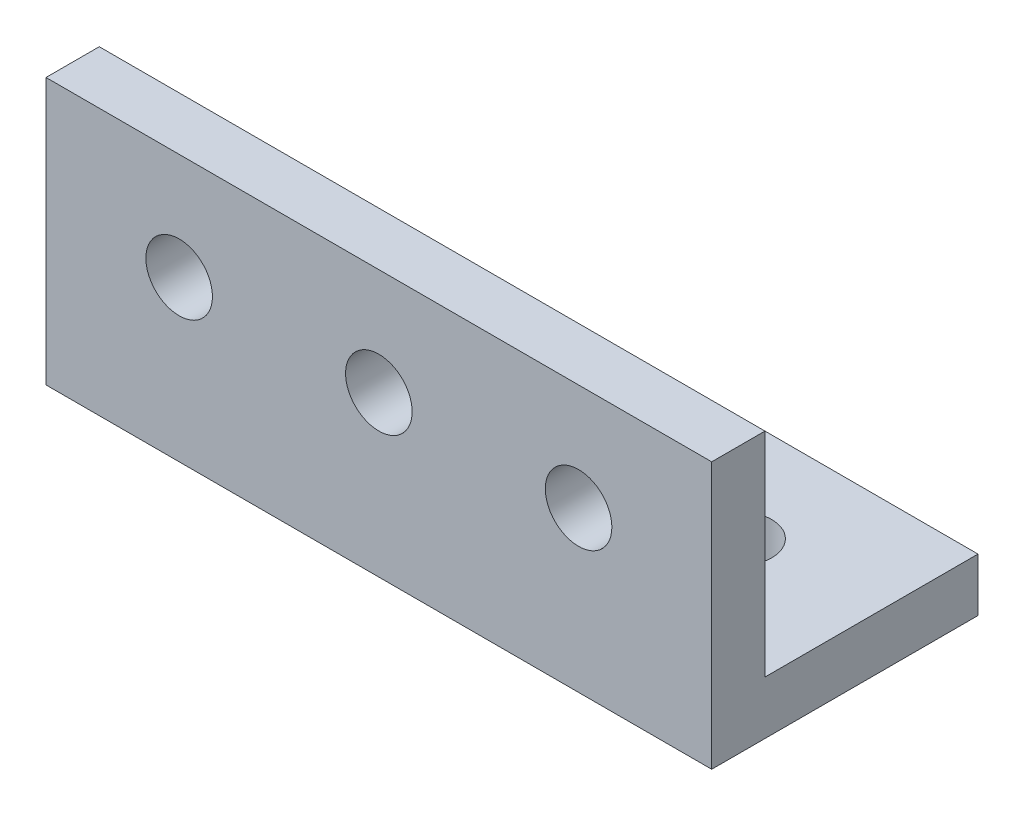
from build123d import *

# Parameters (mm, degrees)
SKETCH_1_W          = 50
SKETCH_1_H          = 20
SKETCH_1_R          = 2.5
EXTRUDE_1_DEPTH     = 4
SKETCH_2_W          = 50
SKETCH_2_H          = 4
EXTRUDE_2_DEPTH     = 16
SKETCH_3_R          = 2.5
CUT_EXTRUDE_1_DEPTH = 4


with BuildPart() as part:
    # Эскиз1 → Бобышка-Вытянуть1 (new body)
    with BuildSketch(Plane(origin=(0, 0, 0), x_dir=(1, 0, 0), z_dir=(0, 1, 0))):
        with Locations((25, 10)):
            Rectangle(SKETCH_1_W, SKETCH_1_H)
        with Locations(Location((10, 12, 0), (0, 0, 270))):
            Circle(SKETCH_1_R, mode=Mode.SUBTRACT)
        with Locations(Location((40, 12, 0), (0, 0, 270))):
            Circle(SKETCH_1_R, mode=Mode.SUBTRACT)
        with Locations(Location((25, 12, 0), (0, 0, 270))):
            Circle(SKETCH_1_R, mode=Mode.SUBTRACT)
    extrude(amount=EXTRUDE_1_DEPTH)

    # Эскиз2 → Бобышка-Вытянуть2 (add)
    with BuildSketch(Plane(origin=(0, 4, 0), x_dir=(1, 0, 0), z_dir=(0, 1, 0))):
        with Locations((25, 2)):
            Rectangle(SKETCH_2_W, SKETCH_2_H)
    extrude(amount=EXTRUDE_2_DEPTH)

    # Эскиз3 → Вырез-Вытянуть1 (cut)
    with BuildSketch(Plane.XY):
        with Locations((10, 12)):
            Circle(SKETCH_3_R)
        with Locations((40, 12)):
            Circle(SKETCH_3_R)
        with Locations((25, 12)):
            Circle(SKETCH_3_R)
    extrude(amount=-CUT_EXTRUDE_1_DEPTH, mode=Mode.SUBTRACT)


solid = part.part
